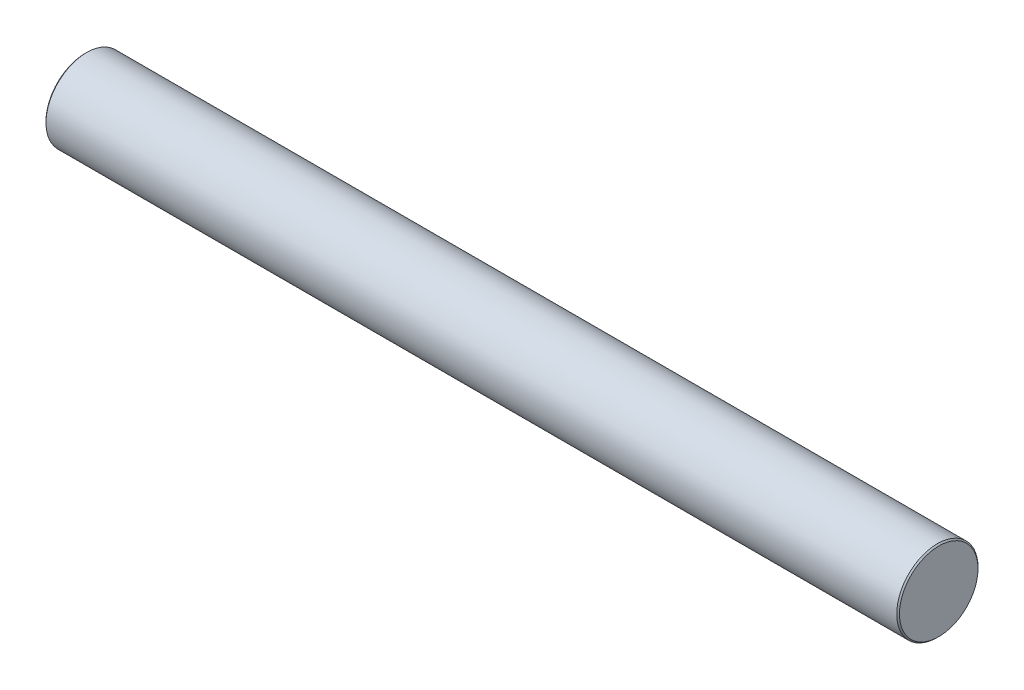
from build123d import *

# Parameters (mm, degrees)
SKETCH1_W     = 63
SKETCH1_H     = 3
CHAMFER1_SIZE = 0.1


with BuildPart() as part:
    # Sketch1 → Revolve1 (revolve)
    with BuildSketch(Plane.XY):
        with Locations((0, 1.5)):
            Rectangle(SKETCH1_W, SKETCH1_H)
    revolve(axis=Axis((-18.852351046, 0, 0), (-1, 0, 0)))

    # Chamfer1
    chamfer1_edges = [part.edges().sort_by_distance(p)[0] for p in [
        (-31.5, -3, 0),
        (31.5, -3, 0),
    ]]
    chamfer(chamfer1_edges, length=CHAMFER1_SIZE)


solid = part.part
